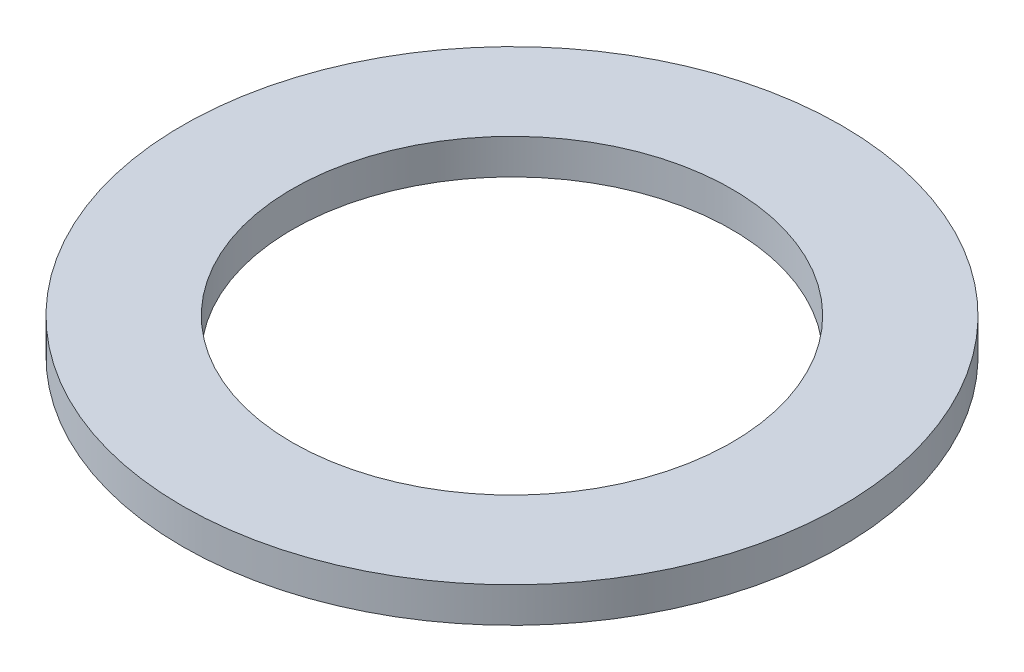
from build123d import *

# Parameters (mm, degrees)
SKETCH1_R           = 9.525
SKETCH1_R_2         = 6.35
BOSS_EXTRUDE1_DEPTH = 1.016


with BuildPart() as part:
    # Sketch1 → Boss-Extrude1 (new body)
    with BuildSketch(Plane(origin=(0, 0, 0), x_dir=(1, 0, 0), z_dir=(0, 1, 0))):
        with Locations(Location((0, 0, 0), (0, 0, 270))):
            Circle(SKETCH1_R)
        with Locations(Location((0, 0, 0), (0, 0, 270))):
            Circle(SKETCH1_R_2, mode=Mode.SUBTRACT)
    extrude(amount=BOSS_EXTRUDE1_DEPTH)


solid = part.part
